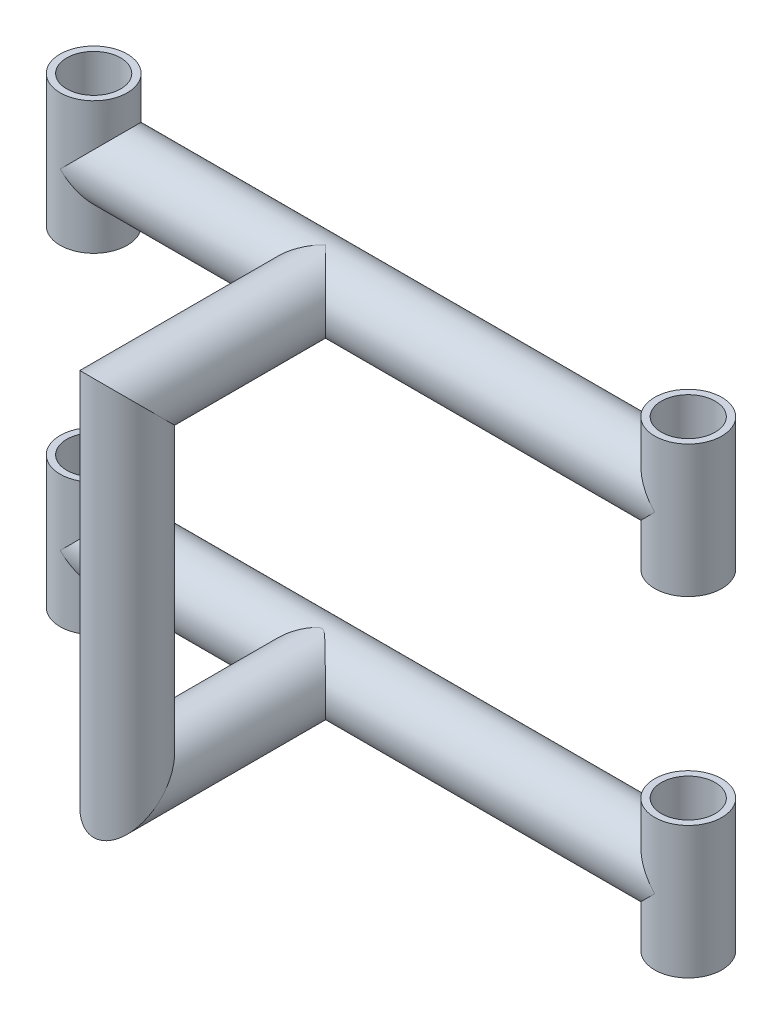
from build123d import *
from build123d.topology import SkipClean

# Parameters (mm, degrees)
CROQUIS1_R                = 25.4
CROQUIS1_R_2              = 20.4
SALIENTE_EXTRUIR1_DEPTH   = 100
CROQUIS7_R                = 25.4
CROQUIS7_R_2              = 23.4
SALIENTE_EXTRUIR2_DEPTH   = 450
CROQUIS8_R                = 25.4
CROQUIS8_R_2              = 20.4
SALIENTE_EXTRUIR3_DEPTH   = 50
SALIENTE_EXTRUIR3_2_DEPTH = 50
CROQUIS9_R                = 25.4
CROQUIS9_R_2              = 23.4
SALIENTE_EXTRUIR4_DEPTH   = 450
CROQUIS10_R               = 25.4
CROQUIS15_R               = 20.4
CORTAR_EXTRUIR1_DEPTH     = 589.872074474
CROQUIS15_2_R             = 20.4
CORTAR_EXTRUIR2_DEPTH     = 589.872074474


with BuildPart() as part:
    # Croquis1 → Saliente-Extruir1 (new body)
    with BuildSketch(Plane(origin=(0, 0, 0), x_dir=(1, 0, 0), z_dir=(0, 1, 0))):
        Circle(CROQUIS1_R)
        Circle(CROQUIS1_R_2, mode=Mode.SUBTRACT)
    saliente_extruir1 = extrude(amount=SALIENTE_EXTRUIR1_DEPTH)

    # Croquis7 → Saliente-Extruir2 (add)
    with BuildSketch(Plane(origin=(0, 0, 0), x_dir=(0, 0, -1), z_dir=(1, 0, 0))):
        with Locations((0, 50)):
            Circle(CROQUIS7_R)
        with Locations((0, 50)):
            Circle(CROQUIS7_R_2, mode=Mode.SUBTRACT)
    extrude(amount=SALIENTE_EXTRUIR2_DEPTH)

    # Simetría1: Saliente-Extruir1 across plane
    add(saliente_extruir1.mirror(Plane(origin=(225, 0, 0), x_dir=(0, 0, 1), z_dir=(1, 0, 0))))



with BuildPart() as body_2:
    # Croquis8 → Saliente-Extruir3 (new, symmetric)
    with BuildSketch(Plane(origin=(0, -200, 0), x_dir=(1, 0, 0), z_dir=(0, 1, 0))):
        Circle(CROQUIS8_R)
        Circle(CROQUIS8_R_2, mode=Mode.SUBTRACT)
    extrude(amount=SALIENTE_EXTRUIR3_DEPTH, both=True)



with BuildPart() as body_3:
    # Croquis8 → Saliente-Extruir3 2 (new, symmetric)
    with BuildSketch(Plane(origin=(0, -200, 0), x_dir=(1, 0, 0), z_dir=(0, 1, 0))):
        with Locations((450, 0)):
            Circle(CROQUIS8_R)
        with Locations((450, 0)):
            Circle(CROQUIS8_R_2, mode=Mode.SUBTRACT)
    extrude(amount=SALIENTE_EXTRUIR3_2_DEPTH, both=True)


with BuildPart() as body_2_1:
    add(body_2.part)

    add(body_3.part)  # Saliente-Extruir4 merges body 3
    # Croquis9 → Saliente-Extruir4 (add)
    with BuildSketch(Plane(origin=(0, 0, 0), x_dir=(0, 0, -1), z_dir=(1, 0, 0))):
        with Locations((0, -200)):
            Circle(CROQUIS9_R)
        with Locations((0, -200)):
            Circle(CROQUIS9_R_2, mode=Mode.SUBTRACT)
    extrude(amount=SALIENTE_EXTRUIR4_DEPTH)


with BuildPart() as part_1:
    add(part.part)

    add(body_2_1.part)  # Barrer3 merges body 2
    # Barrer3: sweep along a path in Croquis14
    with BuildLine(Plane(origin=(225, 0, 0), x_dir=(0, 0, -1), z_dir=(1, 0, 0))) as barrer3_path:
        Line((0, 50), (-150, 50))
        Line((-150, 50), (-150, -200.146423201))
        Line((-150, -200.146423201), (0, -200.146423201))
    # Croquis10 → Barrer3 (sweep)
    with BuildSketch(Plane.XY):
        with Locations((175.4, 50)):
            Circle(CROQUIS10_R)
    sweep(path=barrer3_path.line, transition=Transition.RIGHT)

    # Croquis15 → Cortar-Extruir1 (cut, through all)
    with SkipClean():  # the faces are left unmerged after this step: merging them gives an invalid solid
        with BuildSketch(Plane(origin=(0, -200, 0), x_dir=(1, 0, 0), z_dir=(0, 1, 0))):
            Circle(CROQUIS15_R)
            with Locations((450, 0)):
                Circle(CROQUIS15_R)
        extrude(amount=CORTAR_EXTRUIR1_DEPTH, mode=Mode.SUBTRACT)

    # Croquis15<2> → Cortar-Extruir2 (cut, through all)
    with SkipClean():  # the faces are left unmerged after this step: merging them gives an invalid solid
        with BuildSketch(Plane(origin=(0, -200, 0), x_dir=(1, 0, 0), z_dir=(0, 1, 0))):
            Circle(CROQUIS15_2_R)
            with Locations((450, 0)):
                Circle(CROQUIS15_2_R)
        extrude(amount=-CORTAR_EXTRUIR2_DEPTH, mode=Mode.SUBTRACT)


solid = part_1.part
